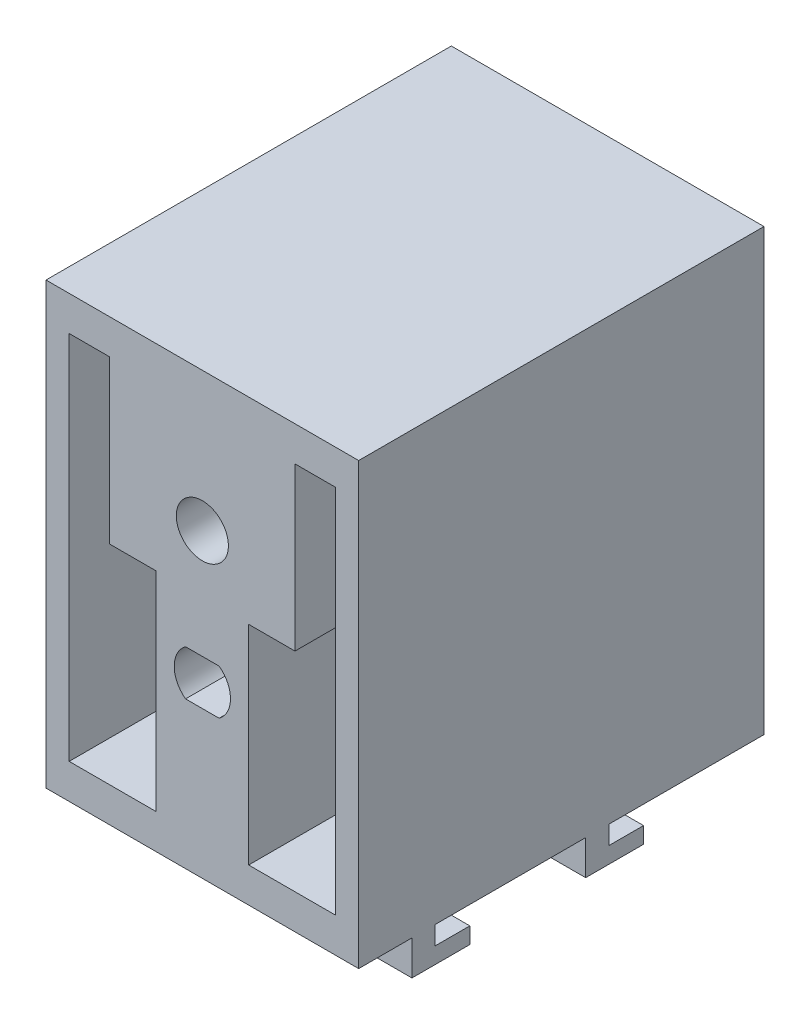
from build123d import *

# Parameters (mm, degrees)
SKETCH1_W            = 68.58
SKETCH1_H            = 88.9
BOSS_EXTRUDE1_DEPTH  = 96.52
SKETCH2_W            = 58.42
SKETCH2_H            = 81.28
CUT_EXTRUDE1_DEPTH   = 149.062611081
SKETCH3_W            = 20.32
SKETCH3_H            = 12.7
BOSS_EXTRUDE2_DEPTH  = 38.1
SKETCH4_W            = 20.32
SKETCH4_H            = 19.05
BOSS_EXTRUDE3_DEPTH  = 12.7
SKETCH5_W            = 20.32
SKETCH5_H            = 9.525
BOSS_EXTRUDE4_DEPTH  = 7.62
CUT_EXTRUDE2_DEPTH   = 141.804001364
SKETCH7_W            = 68.58
SKETCH7_H            = 5.08
BOSS_EXTRUDE5_DEPTH  = 7.62
SKETCH8_W            = 68.58
SKETCH8_H            = 3.556
BOSS_EXTRUDE6_DEPTH  = 7.62
SKETCH9_W            = 68.58
SKETCH9_H            = 3.556
BOSS_EXTRUDE7_DEPTH  = 7.62
SKETCH10_W           = 40.64
SKETCH10_H           = 12.7
BOSS_EXTRUDE8_DEPTH  = 35.56
SKETCH11_R           = 5.715
CUT_EXTRUDE3_DEPTH   = 140.7147774
BOSS_EXTRUDE9_START  = 2.032
SKETCH13_W           = 40.64
SKETCH13_H           = 35.56
SKETCH13_R           = 5.715
BOSS_EXTRUDE9_DEPTH  = 2.032
SKETCH15_W           = 20.32
SKETCH15_H           = 12.7
BOSS_EXTRUDE10_DEPTH = 7.62
BOSS_EXTRUDE11_START = 12.7
SKETCH16_R           = 5.715
BOSS_EXTRUDE11_DEPTH = 12.7


with BuildPart() as part:
    # Sketch1 → Boss-Extrude1 (new body)
    with BuildSketch(Plane(origin=(0, 0, 0), x_dir=(-1, 0, 0), z_dir=(0, 1, 0))):
        with Locations((34.29, 44.45)):
            Rectangle(SKETCH1_W, SKETCH1_H)
    extrude(amount=BOSS_EXTRUDE1_DEPTH)

    # Sketch2 → Cut-Extrude1 (cut, through all)
    with BuildSketch(Plane.XY.offset(88.9)):
        with Locations((-34.29, 48.26)):
            Rectangle(SKETCH2_W, SKETCH2_H)
    extrude(amount=-CUT_EXTRUDE1_DEPTH, mode=Mode.SUBTRACT)

    # Sketch3 → Boss-Extrude2 (add)
    with BuildSketch(Plane(origin=(0, 7.62, 0), x_dir=(-1, 0, 0), z_dir=(0, 1, 0))):
        with Locations((34.29, 69.85)):
            Rectangle(SKETCH3_W, SKETCH3_H)
    extrude(amount=BOSS_EXTRUDE2_DEPTH)

    # Sketch4 → Boss-Extrude3 (add)
    with BuildSketch(Plane(origin=(0, 0, 63.5), x_dir=(1, 0, 0), z_dir=(0, 0, -1))):
        with Locations((-34.29, -17.145)):
            Rectangle(SKETCH4_W, SKETCH4_H)
    extrude(amount=BOSS_EXTRUDE3_DEPTH)

    # Sketch5 → Boss-Extrude4 (add)
    with BuildSketch(Plane(origin=(0, 0, 50.8), x_dir=(1, 0, 0), z_dir=(0, 0, -1))):
        with Locations((-34.29, -12.3825)):
            Rectangle(SKETCH5_W, SKETCH5_H)
    extrude(amount=BOSS_EXTRUDE4_DEPTH)

    # Sketch6 → Cut-Extrude2 (cut, through all)
    with BuildSketch(Plane.XY.offset(76.2)):
        with BuildLine():
            Line((-37.973, 42.164), (-30.607, 42.164))
            ThreePointArc((-30.607, 42.164), (-28.117747737, 37.211), (-30.607, 32.258))
            Line((-30.607, 32.258), (-37.973, 32.258))
            ThreePointArc((-37.973, 32.258), (-40.462252263, 37.211), (-37.973, 42.164))
        make_face()
    extrude(amount=-CUT_EXTRUDE2_DEPTH, mode=Mode.SUBTRACT)

    # Sketch7 → Boss-Extrude5 (add)
    with BuildSketch(Plane.XZ):
        with Locations((-34.29, 74.676)):
            Rectangle(SKETCH7_W, SKETCH7_H)
        with Locations((-34.29, 36.576)):
            Rectangle(SKETCH7_W, SKETCH7_H)
    extrude(amount=BOSS_EXTRUDE5_DEPTH)

    # Sketch8 → Boss-Extrude6 (add)
    with BuildSketch(Plane(origin=(0, 0, 72.136), x_dir=(1, 0, 0), z_dir=(0, 0, -1))):
        with Locations((-34.29, 5.842)):
            Rectangle(SKETCH8_W, SKETCH8_H)
    extrude(amount=BOSS_EXTRUDE6_DEPTH)

    # Sketch9 → Boss-Extrude7 (add)
    with BuildSketch(Plane(origin=(0, 0, 34.036), x_dir=(1, 0, 0), z_dir=(0, 0, -1))):
        with Locations((-34.29, 5.842)):
            Rectangle(SKETCH9_W, SKETCH9_H)
    extrude(amount=BOSS_EXTRUDE7_DEPTH)

    # Sketch10 → Boss-Extrude8 (add)
    with BuildSketch(Plane.XZ.offset(-88.9)):
        with Locations((-34.29, 67.818)):
            Rectangle(SKETCH10_W, SKETCH10_H)
    extrude(amount=BOSS_EXTRUDE8_DEPTH)

    # Sketch11 → Cut-Extrude3 (cut, through all)
    with BuildSketch(Plane.XY.offset(74.168)):
        with Locations((-34.29, 66.04)):
            Circle(SKETCH11_R)
    extrude(amount=-CUT_EXTRUDE3_DEPTH, mode=Mode.SUBTRACT)

    # Sketch13 → Boss-Extrude9 (add)
    with BuildSketch(Plane.XY.offset(74.168).offset(BOSS_EXTRUDE9_START)):
        with Locations((-34.29, 71.12)):
            Rectangle(SKETCH13_W, SKETCH13_H)
        with Locations((-34.29, 66.04)):
            Circle(SKETCH13_R, mode=Mode.SUBTRACT)
    extrude(amount=-BOSS_EXTRUDE9_DEPTH)

    # Sketch15 → Boss-Extrude10 (add)
    with BuildSketch(Plane(origin=(0, 45.72, 0), x_dir=(-1, 0, 0), z_dir=(0, 1, 0))):
        with Locations((34.29, 69.85)):
            Rectangle(SKETCH15_W, SKETCH15_H)
    extrude(amount=BOSS_EXTRUDE10_DEPTH)

    # Sketch16 → Boss-Extrude11 (add)
    with BuildSketch(Plane.XY.offset(76.2).offset(BOSS_EXTRUDE11_START)):
        Polygon((-54.61, 88.9), (-13.97, 88.9), (-13.97, 53.34), (-24.13, 53.34), (-24.13, 7.62), (-44.45, 7.62), (-44.45, 53.34), (-54.61, 53.34), align=None)
        with Locations((-34.29, 66.04)):
            Circle(SKETCH16_R, mode=Mode.SUBTRACT)
        with BuildLine():
            Line((-37.973, 42.164), (-30.607, 42.164))
            ThreePointArc((-30.607, 42.164), (-28.117747737, 37.211), (-30.607, 32.258))
            Line((-30.607, 32.258), (-37.973, 32.258))
            ThreePointArc((-37.973, 32.258), (-40.462252263, 37.211), (-37.973, 42.164))
        make_face(mode=Mode.SUBTRACT)
    extrude(amount=-BOSS_EXTRUDE11_DEPTH)


solid = part.part
